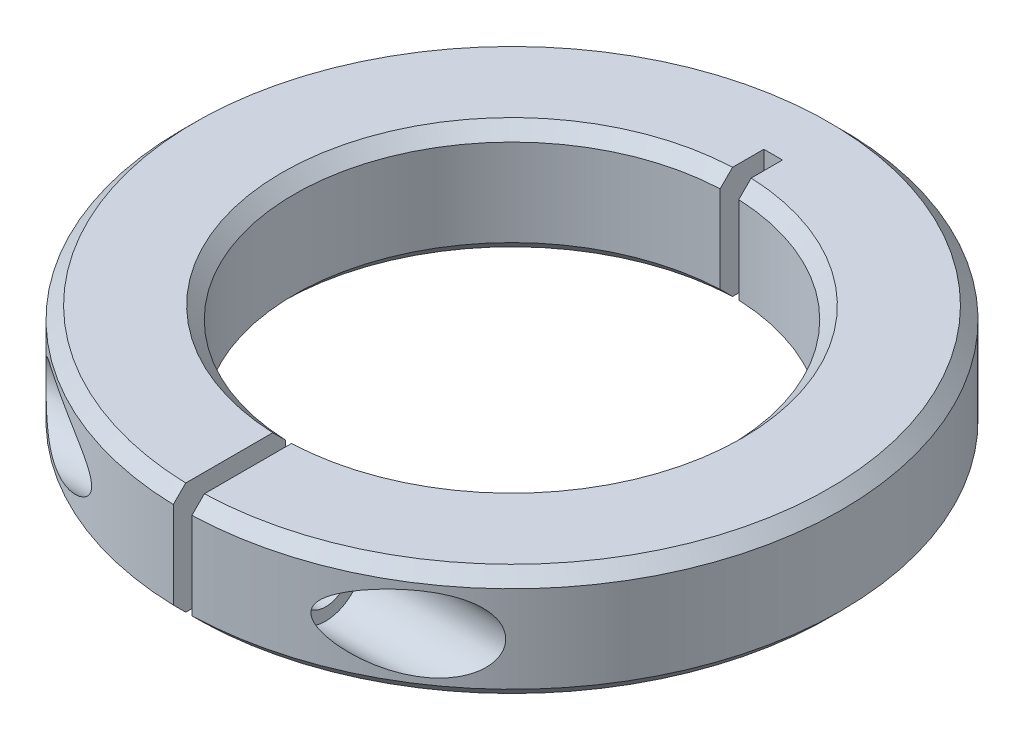
from build123d import *

# Parameters (mm, degrees)
BOSS_EXTRUDE1_DEPTH     = 4.5
CHAMFER2_SIZE           = 1
CHAMFER3_SIZE           = 1
CUT_EXTRUDE1_DEPTH      = 38.7458607
CUT_EXTRUDE1_DEPTH_BACK = 38.7458607
SKETCH2_R               = 2
SKETCH3_R               = 3
CUT_EXTRUDE4_DEPTH      = 13


with BuildPart() as part:
    # Sketch1 → Boss-Extrude1 (new, symmetric)
    with BuildSketch(Plane(origin=(0, 0, 0), x_dir=(1, 0, 0), z_dir=(0, 1, 0))):
        with BuildLine():
            Line((-0.75, 21), (0.75, 21))
            Line((0.75, 21), (0.75, 17.483921185))
            ThreePointArc((0.75, 17.483921185), (17.5, 0), (0.75, -17.483921185))
            Line((0.75, -17.483921185), (0.75, -26.489384666))
            ThreePointArc((0.75, -26.489384666), (0, 26.5), (-0.75, -26.489384666))
            Line((-0.75, -26.489384666), (-0.75, -17.483921185))
            ThreePointArc((-0.75, -17.483921185), (-17.5, 0), (-0.75, 17.483921185))
            Line((-0.75, 17.483921185), (-0.75, 21))
        make_face()
    extrude(amount=BOSS_EXTRUDE1_DEPTH, both=True)

    # Chamfer2
    chamfer2_edges = [part.edges().sort_by_distance(p)[0] for p in [
        (0, 4.5, -26.5),
        (-17.5, 4.5, 0),
        (17.5, 4.5, 0),
    ]]
    chamfer(chamfer2_edges, length=CHAMFER2_SIZE)

    # Chamfer3
    chamfer3_edges = [part.edges().sort_by_distance(p)[0] for p in [
        (0, -4.5, -26.5),
        (17.5, -4.5, 0),
        (-17.5, -4.5, 0),
    ]]
    chamfer(chamfer3_edges, length=CHAMFER3_SIZE)

    # Sketch2 → Cut-Extrude1 (cut, two sides: drawn at the far end of the back side and taken through both)
    with BuildSketch(Plane(origin=(0, 0, 0), x_dir=(0, 0, -1), z_dir=(1, 0, 0)).offset(-CUT_EXTRUDE1_DEPTH_BACK)):
        with Locations((-21.989789185, 0)):
            Circle(SKETCH2_R)
    extrude(amount=CUT_EXTRUDE1_DEPTH + CUT_EXTRUDE1_DEPTH_BACK, mode=Mode.SUBTRACT)

    # Sketch3 → Cut-Extrude4 (cut)
    with BuildSketch(Plane(origin=(20, 0, 0), x_dir=(0, 0, -1), z_dir=(1, 0, 0))):
        with Locations((-21.989789185, 0)):
            Circle(SKETCH3_R)
    cut_extrude4 = extrude(amount=-CUT_EXTRUDE4_DEPTH, mode=Mode.SUBTRACT)

    # Mirror3: Cut-Extrude4 across plane
    add(cut_extrude4.mirror(Plane(origin=(0, 0, 0), x_dir=(0, 0, 1), z_dir=(1, 0, 0))), mode=Mode.SUBTRACT)


solid = part.part
